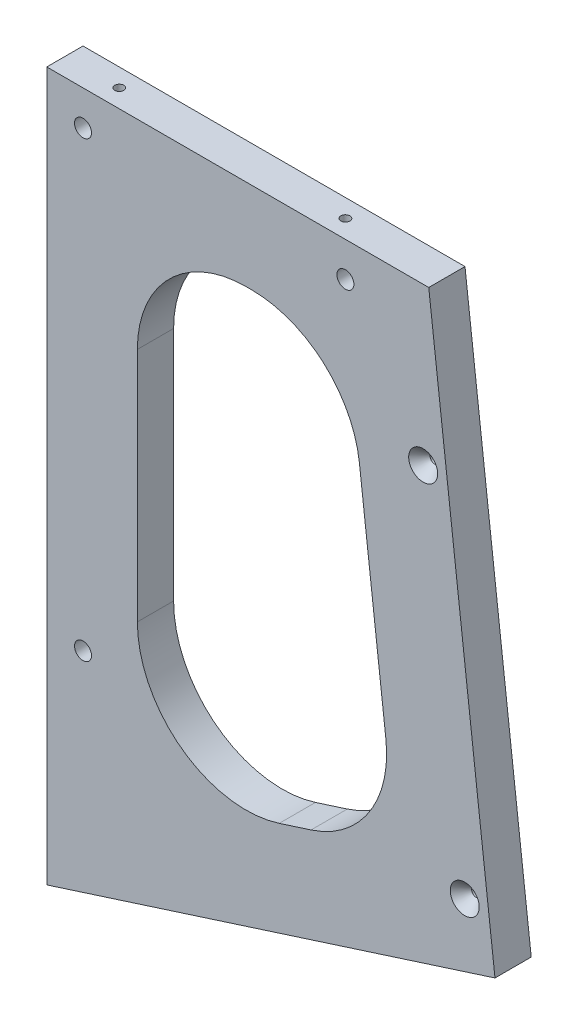
from build123d import *

# Parameters (mm, degrees)
BOSS_EXTRUDE1_DEPTH              = 12.7
HOLE3_D                          = 3.175
HOLE3_DEPTH                      = 31.75
HOLE3_CSINK_D                    = 10.16
HOLE3_CSINK_ANGLE                = 82
HOLE3_TIP                        = 0.953866233
HOLE6_D                          = 3.175
HOLE6_DEPTH                      = 38.1
HOLE6_CSINK_D                    = 10.16
HOLE6_CSINK_ANGLE                = 82
HOLE6_TIP                        = 0.953866233
HOLE7_D                          = 3.175
HOLE7_DEPTH                      = 31.75
HOLE7_CSINK_D                    = 10.16
HOLE7_CSINK_ANGLE                = 82
HOLE7_TIP                        = 0.953866233
HOLE8_D                          = 3.175
HOLE8_DEPTH                      = 31.75
HOLE8_CSINK_D                    = 10.16
HOLE8_CSINK_ANGLE                = 82
HOLE8_TIP                        = 0.953866233
F_15_64_0_23438_DIAMETER_HOLE1_D = 5.953252
F_15_64_0_23438_DIAMETER_HOLE2_D = 5.953252
CUT_EXTRUDE1_DEPTH               = 334.311975083
FILLET1_R                        = 38.1


with BuildPart() as part:
    # Sketch1 → Boss-Extrude1 (new body)
    with BuildSketch(Plane.XY):
        Polygon((-88.190159952, 0), (-222.052967181, 0), (-222.052967181, -248.25), (-64.977416983, -197.966048293), align=None)
    extrude(amount=-BOSS_EXTRUDE1_DEPTH)

    # Hole3
    with Locations(Plane(origin=(-234.752967181, 1073.364195846, -135.816741379), x_dir=(0, 0, -1), z_dir=(-1, 0, 0))):
        with Locations((-129.466741379, 1300.662770337), (-129.466741379, 1128.612770337), (129.198788767, 1128.612770337), (129.198788767, 1300.662770337)):
            CounterSinkHole(HOLE3_D / 2, HOLE3_CSINK_D / 2, depth=HOLE3_DEPTH, counter_sink_angle=HOLE3_CSINK_ANGLE)
            with Locations((0, 0, -(HOLE3_DEPTH + HOLE3_TIP / 2))):  # 118° drill point
                Cone(0, HOLE3_D / 2, HOLE3_TIP, mode=Mode.SUBTRACT)

    # Hole6
    with Locations(Plane(origin=(181.039434513, 1073.364195846, 0), x_dir=(-0.9271838545667885, -0.3746065934159093, 0), z_dir=(0, 0, 1))):
        with Locations((707.166557203, 1065.270372796), (674.127983646, 944.603090451)):
            CounterSinkHole(HOLE6_D / 2, HOLE6_CSINK_D / 2, depth=HOLE6_DEPTH, counter_sink_angle=HOLE6_CSINK_ANGLE)
            with Locations((0, 0, -(HOLE6_DEPTH + HOLE6_TIP / 2))):  # 118° drill point
                Cone(0, HOLE6_D / 2, HOLE6_TIP, mode=Mode.SUBTRACT)

    # Hole7
    with Locations(Plane(origin=(181.039434513, 12.7, -135.816741379), x_dir=(0, 0, -1), z_dir=(0, 1, 0))):
        with Locations((129.198788767, 384.042401694), (-129.466741379, 384.042401694), (-129.466741379, 304.786761906), (-110.416741379, 409.442401694), (-0.133976306, 409.442401694), (110.148788767, 409.442401694), (129.198788767, 304.786761906)):
            CounterSinkHole(HOLE7_D / 2, HOLE7_CSINK_D / 2, depth=HOLE7_DEPTH, counter_sink_angle=HOLE7_CSINK_ANGLE)
            with Locations((0, 0, -(HOLE7_DEPTH + HOLE7_TIP / 2))):  # 118° drill point
                Cone(0, HOLE7_D / 2, HOLE7_TIP, mode=Mode.SUBTRACT)

    # Hole8
    with Locations(Plane(origin=(531.197640696, -20.449854654, -135.816741379), x_dir=(0, 0, 1), z_dir=(0.3048844921716131, -0.9523893355310409, 0))):
        with Locations((-129.257383629, 761.035393152), (129.466741379, 663.01461615), (129.466741379, 760.835922116), (-129.408220012, 663.214203478)):
            CounterSinkHole(HOLE8_D / 2, HOLE8_CSINK_D / 2, depth=HOLE8_DEPTH, counter_sink_angle=HOLE8_CSINK_ANGLE)
            with Locations((0, 0, -(HOLE8_DEPTH + HOLE8_TIP / 2))):  # 118° drill point
                Cone(0, HOLE8_D / 2, HOLE8_TIP, mode=Mode.SUBTRACT)

    # 15/64 (0.23438) Diameter Hole1 (through all)
    with Locations(Plane.XY):
        with Locations((-117.397327374, -12.17947903), (-209.352967162, -12.179479032)):
            Hole(F_15_64_0_23438_DIAMETER_HOLE1_D / 2)

    # 15/64 (0.23438) Diameter Hole2 (through all)
    with Locations(Plane.XY):
        with Locations((-209.352967181, -170.846075828)):
            Hole(F_15_64_0_23438_DIAMETER_HOLE2_D / 2)

    # Sketch22 → Cut-Extrude1 (cut, through all)
    with BuildSketch(Plane.XY):
        Polygon((-99.555964999, -175.698330504), (-116.434796625, -31.75), (-190.302967181, -31.75), (-190.302967181, -204.748796153), align=None)
    extrude(amount=-CUT_EXTRUDE1_DEPTH, mode=Mode.SUBTRACT)

    # Fillet1
    fillet1_edges = [part.edges().sort_by_distance(p)[0] for p in [
        (-99.555964999, -175.698330504, -6.35),
        (-190.302967181, -204.748796153, -6.35),
        (-190.302967181, -31.75, -6.35),
        (-116.434796625, -31.75, -6.35),
    ]]
    fillet(fillet1_edges, radius=FILLET1_R)


solid = part.part
